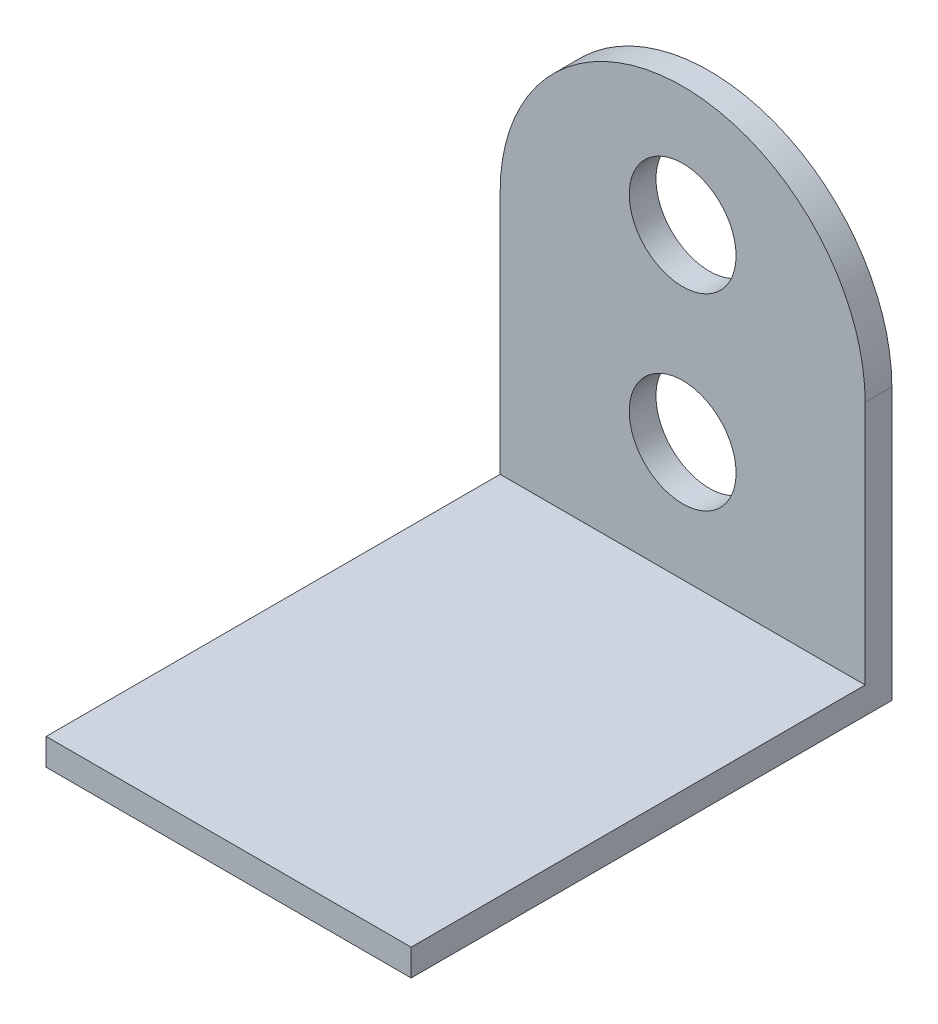
from build123d import *

# Parameters (mm, degrees)
SKETCH1_W               = 41
SKETCH1_H               = 54
BOSS_EXTRUDE1_DEPTH     = 3
SKETCH2_W               = 41
SKETCH2_H               = 3
BOSS_EXTRUDE2_DEPTH     = 48
SKETCH4_R               = 6
CUT_EXTRUDE1_DEPTH      = 145.103724485
CUT_EXTRUDE3_DEPTH      = 145.103724485
CUT_EXTRUDE3_DEPTH_BACK = 145.103724485
SKETCH12_R              = 6
CUT_EXTRUDE4_DEPTH      = 145.103724485


with BuildPart() as part:
    # Sketch1 → Boss-Extrude1 (new body)
    with BuildSketch(Plane(origin=(0, 0, 0), x_dir=(1, 0, 0), z_dir=(0, 1, 0))):
        with Locations((-104.255294118, -7.041782531)):
            Rectangle(SKETCH1_W, SKETCH1_H)
    extrude(amount=BOSS_EXTRUDE1_DEPTH)

    # Sketch2 → Boss-Extrude2 (add)
    with BuildSketch(Plane(origin=(0, 3, 0), x_dir=(1, 0, 0), z_dir=(0, 1, 0))):
        with Locations((-104.255294118, 18.458217469)):
            Rectangle(SKETCH2_W, SKETCH2_H)
    extrude(amount=BOSS_EXTRUDE2_DEPTH)

    # Sketch4 → Cut-Extrude1 (cut, through all)
    with BuildSketch(Plane.XY.offset(-16.958217469)):
        with Locations((-104.255294118, 37.5)):
            Circle(SKETCH4_R)
    extrude(amount=-CUT_EXTRUDE1_DEPTH, mode=Mode.SUBTRACT)

    # Sketch5 → Cut-Extrude3 (cut, two sides: drawn at the far end of the back side and taken through both)
    with BuildSketch(Plane.XY.offset(-16.958217469).offset(-CUT_EXTRUDE3_DEPTH_BACK)):
        with BuildLine():
            Line((-124.755294118, 51), (-124.755294118, 30.5))
            ThreePointArc((-124.755294118, 30.5), (-118.750983132, 44.995689014), (-104.255294118, 51))
            Line((-104.255294118, 51), (-124.755294118, 51))
        make_face()
        with BuildLine():
            ThreePointArc((-104.255294118, 51), (-89.759605103, 44.995689014), (-83.755294118, 30.5))
            Line((-83.755294118, 30.5), (-83.755294118, 51))
            Line((-83.755294118, 51), (-104.255294118, 51))
        make_face()
    extrude(amount=CUT_EXTRUDE3_DEPTH + CUT_EXTRUDE3_DEPTH_BACK, mode=Mode.SUBTRACT)

    # Sketch12 → Cut-Extrude4 (cut, through all)
    with BuildSketch(Plane.XY.offset(-16.958217469)):
        with Locations((-104.255294118, 16.378845884)):
            Circle(SKETCH12_R)
    extrude(amount=-CUT_EXTRUDE4_DEPTH, mode=Mode.SUBTRACT)


solid = part.part
